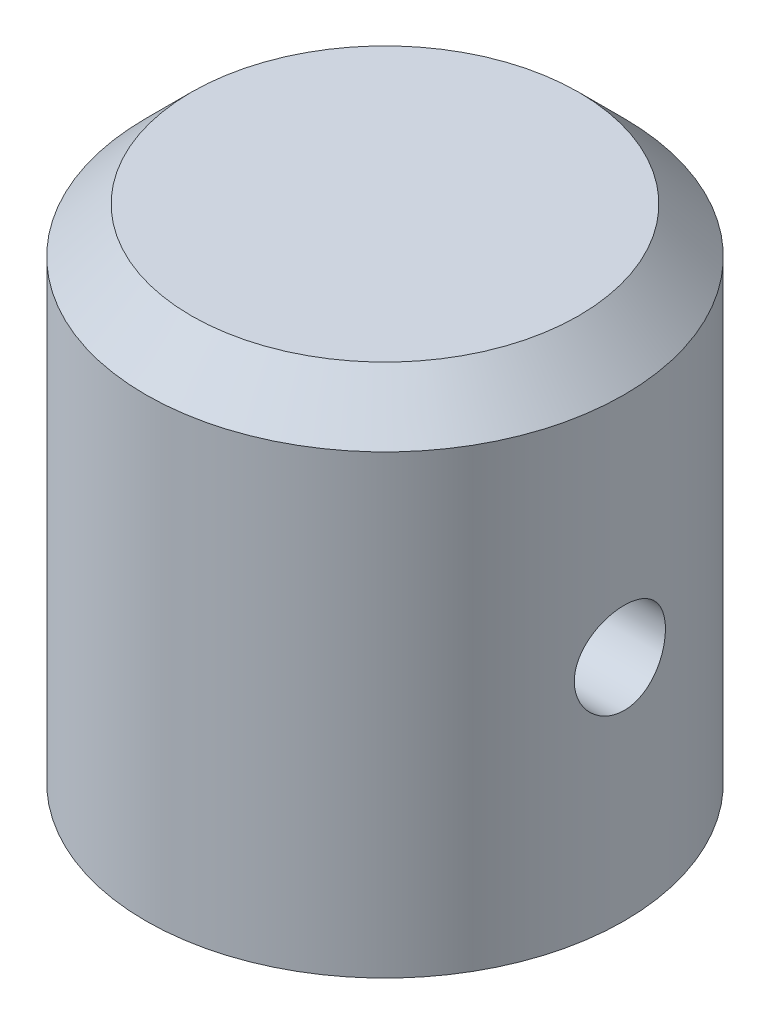
from build123d import *

# Parameters (mm, degrees)
SCHIZZO2_R                    = 10.5
ESTRUSIONE_ESTRUSIONE1_DEPTH  = 22
TAGLIO_ESTRUSIONE1_DEPTH      = 17
SMUSSO1_SIZE                  = 2
TAGLIO_ESTRUSIONE2_DEPTH      = 27.54241888
TAGLIO_ESTRUSIONE2_DEPTH_BACK = 27.54241888
SCHIZZO4_R                    = 2
TAGLIO_ESTRUSIONE3_DEPTH      = 27.542418959
TAGLIO_ESTRUSIONE3_DEPTH_BACK = 19
SCHIZZO5_R                    = 0.9


with BuildPart() as part:
    # Schizzo2 → Estrusione-Estrusione1 (new body)
    with BuildSketch(Plane(origin=(0, 0, 0), x_dir=(1, 0, 0), z_dir=(0, 1, 0))):
        with Locations(Location((0, 0, 0), (0, 0, 270))):
            Circle(SCHIZZO2_R)
    extrude(amount=ESTRUSIONE_ESTRUSIONE1_DEPTH)

    # Schizzo3 → Taglio-Estrusione1 (cut)
    with BuildSketch(Plane.XZ):
        with BuildLine():
            Line((-2.860934268, 7.5), (2.860934268, 7.5))
            ThreePointArc((2.860934268, 7.5), (4.373482153, 6.873482153), (5, 5.360934268))
            Line((5, 5.360934268), (5, -5.360934268))
            ThreePointArc((5, -5.360934268), (4.373482153, -6.873482153), (2.860934268, -7.5))
            Line((2.860934268, -7.5), (-2.860934268, -7.5))
            ThreePointArc((-2.860934268, -7.5), (-4.373482153, -6.873482153), (-5, -5.360934268))
            Line((-5, -5.360934268), (-5, 5.360934268))
            ThreePointArc((-5, 5.360934268), (-4.373482153, 6.873482153), (-2.860934268, 7.5))
        make_face()
    extrude(amount=-TAGLIO_ESTRUSIONE1_DEPTH, mode=Mode.SUBTRACT)

    # Smusso1
    smusso1_edges = [part.edges().sort_by_distance(p)[0] for p in [
        (0, 22, -10.5),
    ]]
    chamfer(smusso1_edges, length=SMUSSO1_SIZE)

    # Schizzo4 → Taglio-Estrusione2 (cut, two sides: drawn at the far end of the back side and taken through both)
    with BuildSketch(Plane(origin=(0, 0, 0), x_dir=(0, 0, -1), z_dir=(1, 0, 0)).offset(-TAGLIO_ESTRUSIONE2_DEPTH_BACK)):
        with Locations(Location((0, 10, 0), (0, 0, 270))):
            Circle(SCHIZZO4_R)
    extrude(amount=TAGLIO_ESTRUSIONE2_DEPTH + TAGLIO_ESTRUSIONE2_DEPTH_BACK, mode=Mode.SUBTRACT)

    # Schizzo5 → Taglio-Estrusione3 (cut, two sides: drawn at the far end of the back side and taken through both)
    with BuildSketch(Plane.XZ.offset(-TAGLIO_ESTRUSIONE3_DEPTH_BACK)):
        with Locations(Location((7, 0, 0), (0, 0, 90))):
            Circle(SCHIZZO5_R)
    extrude(amount=TAGLIO_ESTRUSIONE3_DEPTH + TAGLIO_ESTRUSIONE3_DEPTH_BACK, mode=Mode.SUBTRACT)


solid = part.part
